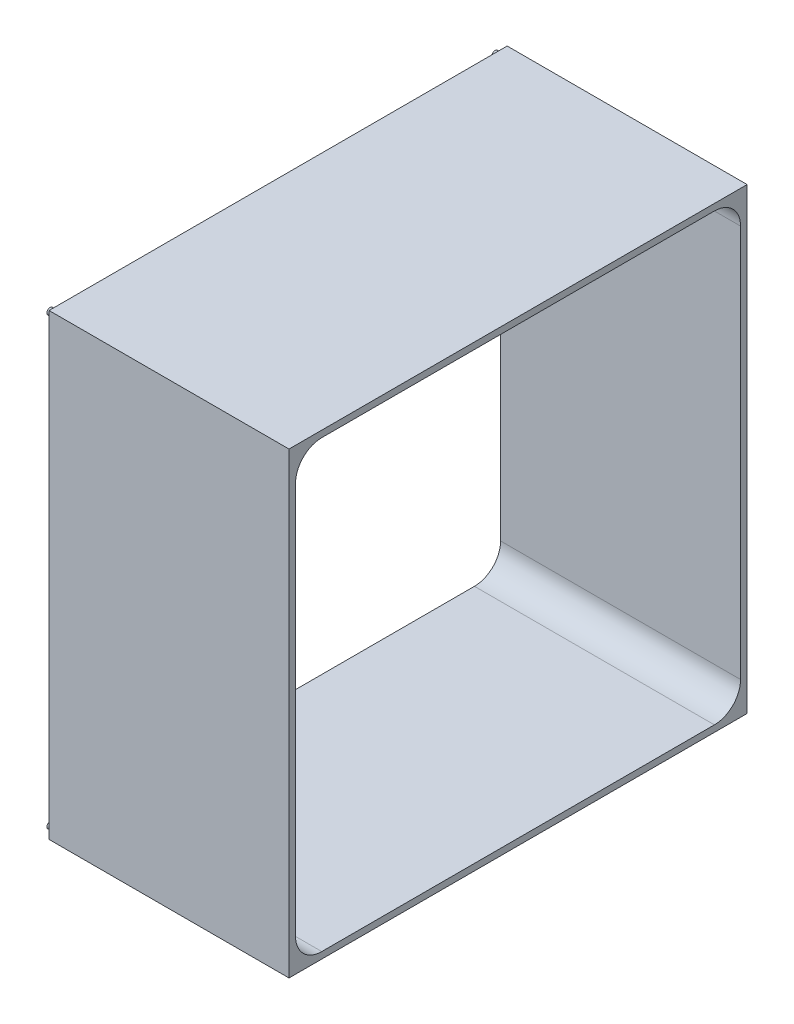
from build123d import *

# Parameters (mm, degrees)
SKETCH1_W               = 210
SKETCH1_H               = 210
BOSS_EXTRUDE1_DEPTH     = 110
SKETCH2_W               = 204
SKETCH2_H               = 204
CUT_EXTRUDE1_DEPTH      = 110
FILLET1_R               = 12
SKETCH3_R               = 1.5
BOSS_EXTRUDE2_DEPTH     = 2.5
MIRROR2_COPY_1_SKETCH_R = 1.5
MIRROR2_COPY_1_DEPTH    = 2.5


with BuildPart() as part:
    # Sketch1 → Boss-Extrude1 (new body)
    with BuildSketch(Plane(origin=(0, 0, 0), x_dir=(0, 0, -1), z_dir=(1, 0, 0))):
        Rectangle(SKETCH1_W, SKETCH1_H)
    extrude(amount=BOSS_EXTRUDE1_DEPTH)

    # Sketch2 → Cut-Extrude1 (cut)
    with BuildSketch(Plane(origin=(110, 0, 0), x_dir=(0, 0, -1), z_dir=(1, 0, 0))):
        Rectangle(SKETCH2_W, SKETCH2_H)
    extrude(amount=-CUT_EXTRUDE1_DEPTH, mode=Mode.SUBTRACT)

    # Fillet1
    fillet1_edges = [part.edges().sort_by_distance(p)[0] for p in [
        (55, -102, -102),
        (55, -102, 102),
        (55, 102, 102),
        (55, 102, -102),
    ]]
    fillet(fillet1_edges, radius=FILLET1_R)

    # Sketch3 → Boss-Extrude2 (add)
    with BuildSketch(Plane.ZY):
        with Locations((-102, 102)):
            Circle(SKETCH3_R)
    boss_extrude2 = extrude(amount=BOSS_EXTRUDE2_DEPTH)

    # Mirror1: Boss-Extrude2 across plane
    add(boss_extrude2.mirror(Plane.XY))

    # Mirror2: Boss-Extrude2 across plane
    add(boss_extrude2.mirror(Plane.ZX))

    # Mirror2 copy 1 sketch → Mirror2 copy 1 (add)
    with BuildSketch(Plane(origin=(0, 0, 0), x_dir=(0, 0, -1), z_dir=(-1, 0, 0))):
        with Locations((-102, 102)):
            Circle(MIRROR2_COPY_1_SKETCH_R)
    extrude(amount=MIRROR2_COPY_1_DEPTH)


solid = part.part
